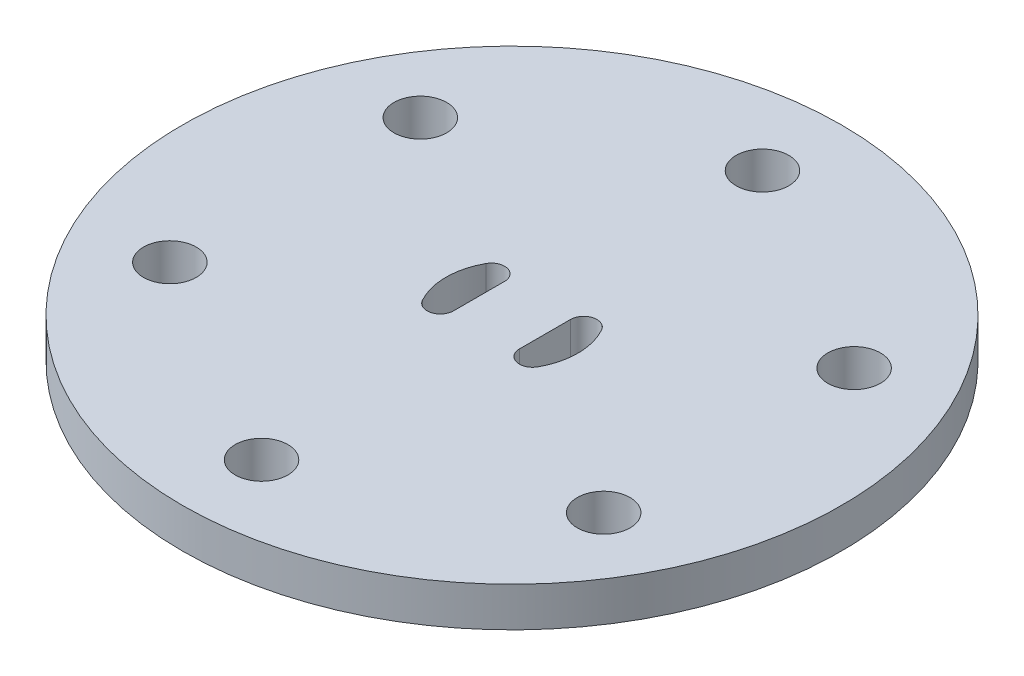
from build123d import *

# Parameters (mm, degrees)
SKETCH_1_R      = 25
SKETCH_1_R_2    = 2
SKETCH_1_R_3    = 5
EXTRUDE_1_DEPTH = 3
SKETCH_2_W      = 5
SKETCH_2_H      = 12
EXTRUDE_2_DEPTH = 3
FILLET_1_R      = 1


with BuildPart() as part:
    # 草图1 → 凸台-拉伸1 (new body)
    with BuildSketch(Plane(origin=(0, 0, 0), x_dir=(1, 0, 0), z_dir=(0, 1, 0))):
        with Locations(Location((0, 0, 0), (0, 0, 270))):
            Circle(SKETCH_1_R)
        with Locations(Location((0, 19, 0), (0, 0, 270))):
            Circle(SKETCH_1_R_2, mode=Mode.SUBTRACT)
        with Locations(Location((16.454482672, 9.5, 0), (0, 0, 270))):
            Circle(SKETCH_1_R_2, mode=Mode.SUBTRACT)
        with Locations(Location((16.454482672, -9.5, 0), (0, 0, 270))):
            Circle(SKETCH_1_R_2, mode=Mode.SUBTRACT)
        with Locations(Location((0, -19, 0), (0, 0, 270))):
            Circle(SKETCH_1_R_2, mode=Mode.SUBTRACT)
        with Locations(Location((-16.454482672, -9.5, 0), (0, 0, 270))):
            Circle(SKETCH_1_R_2, mode=Mode.SUBTRACT)
        with Locations(Location((-16.454482672, 9.5, 0), (0, 0, 270))):
            Circle(SKETCH_1_R_2, mode=Mode.SUBTRACT)
        with Locations(Location((0, 0, 0), (0, 0, 270))):
            Circle(SKETCH_1_R_3, mode=Mode.SUBTRACT)
    extrude(amount=EXTRUDE_1_DEPTH)

    # 草图2 → 凸台-拉伸2 (add)
    with BuildSketch(Plane(origin=(0, 3, 0), x_dir=(1, 0, 0), z_dir=(0, 1, 0))):
        Rectangle(SKETCH_2_W, SKETCH_2_H)
    extrude(amount=-EXTRUDE_2_DEPTH)

    # 圆角1
    fillet_1_edges = [part.edges().sort_by_distance(p)[0] for p in [
        (-2.5, 1.5, 4.330127019),
        (-2.5, 1.5, -4.330127019),
        (2.5, 1.5, -4.330127019),
        (2.5, 1.5, 4.330127019),
    ]]
    fillet(fillet_1_edges, radius=FILLET_1_R)


solid = part.part
